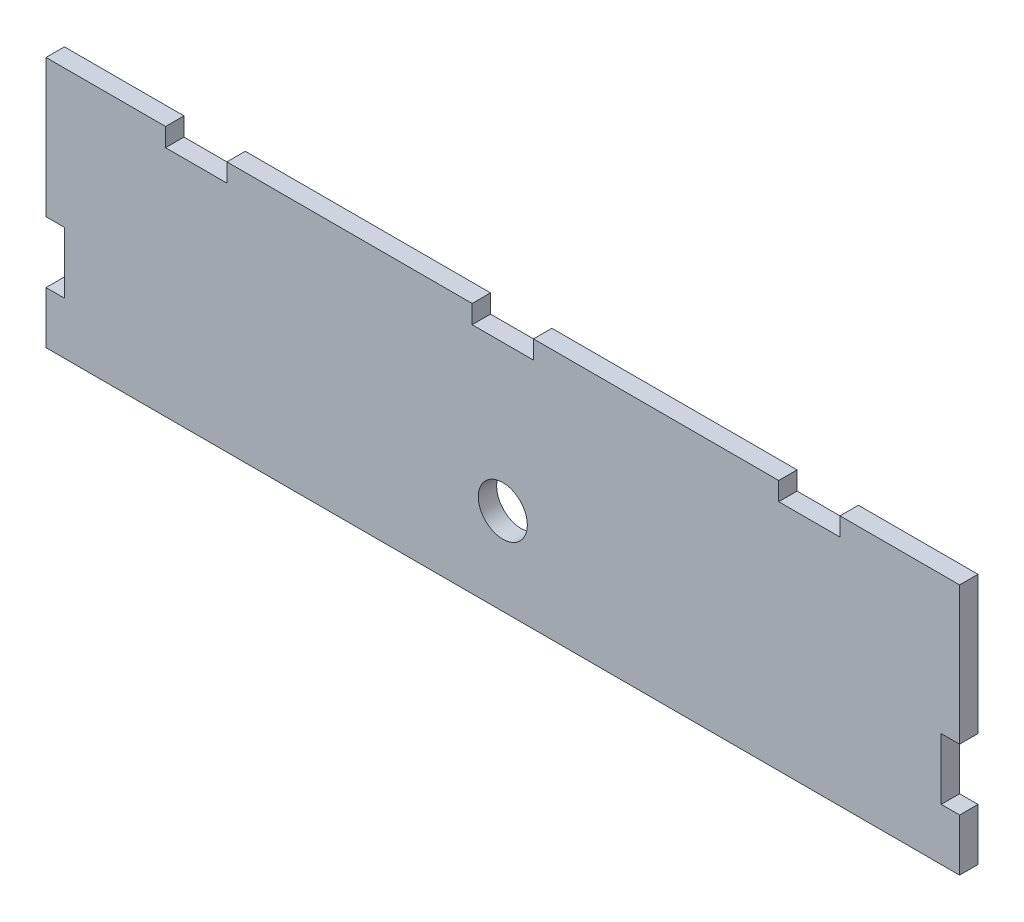
from build123d import *

# Parameters (mm, degrees)
BOSS_EXTRUDE1_DEPTH = 3
SKETCH2_R           = 4
CUT_EXTRUDE1_DEPTH  = 80.298486745


with BuildPart() as part:
    # Sketch1 → Boss-Extrude1 (new body)
    with BuildSketch(Plane.XY):
        Polygon((-74.5, 14), (-74.5, -8.5), (-71.5, -8.5), (-71.5, -18.5), (-74.5, -18.5), (-74.5, -27), (74.5, -27), (74.5, -18.5), (71.5, -18.5), (71.5, -8.5), (74.5, -8.5), (74.5, 14), (55, 14), (55, 11), (45, 11), (45, 14), (5, 14), (5, 11), (-5, 11), (-5, 14), (-45, 14), (-45, 11), (-55, 11), (-55, 14), align=None)
    extrude(amount=BOSS_EXTRUDE1_DEPTH)

    # Sketch2 → Cut-Extrude1 (cut, through all)
    with BuildSketch(Plane.XY):
        with Locations((0, -12.79)):
            Circle(SKETCH2_R)
    extrude(amount=CUT_EXTRUDE1_DEPTH, mode=Mode.SUBTRACT)


solid = part.part
